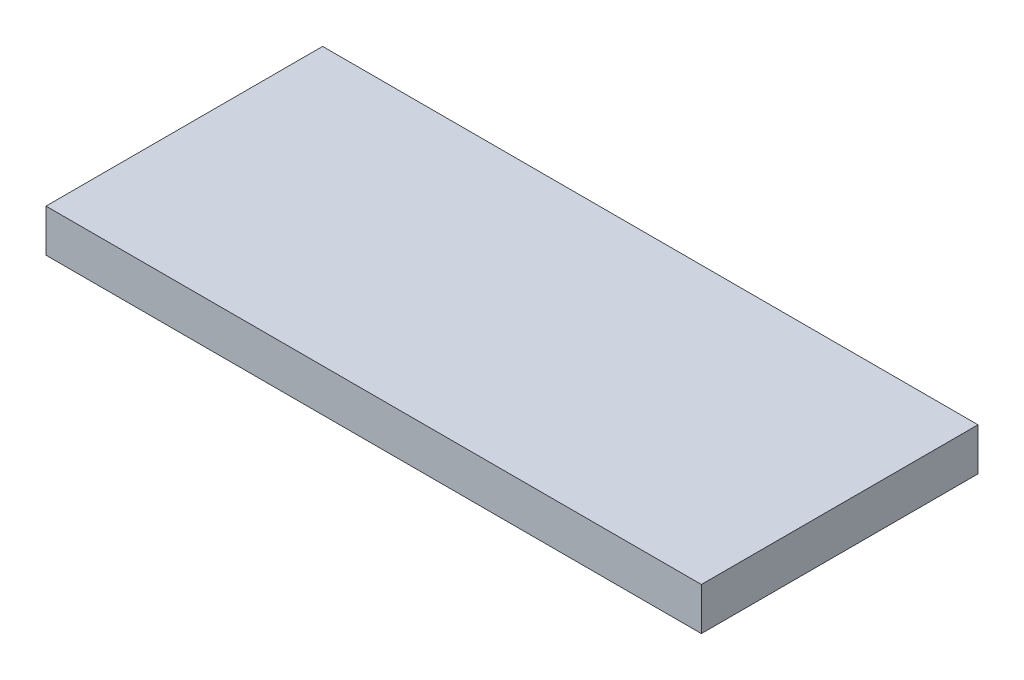
from build123d import *

# Parameters (mm, degrees)
SKETCH1_W  = 154
SKETCH1_H  = 65
BASE_DEPTH = 10


with BuildPart() as part:
    # Sketch1 → base (new body)
    with BuildSketch(Plane(origin=(0, 0, 0), x_dir=(1, 0, 0), z_dir=(0, 1, 0))):
        Rectangle(SKETCH1_W, SKETCH1_H)
    extrude(amount=BASE_DEPTH)


solid = part.part
